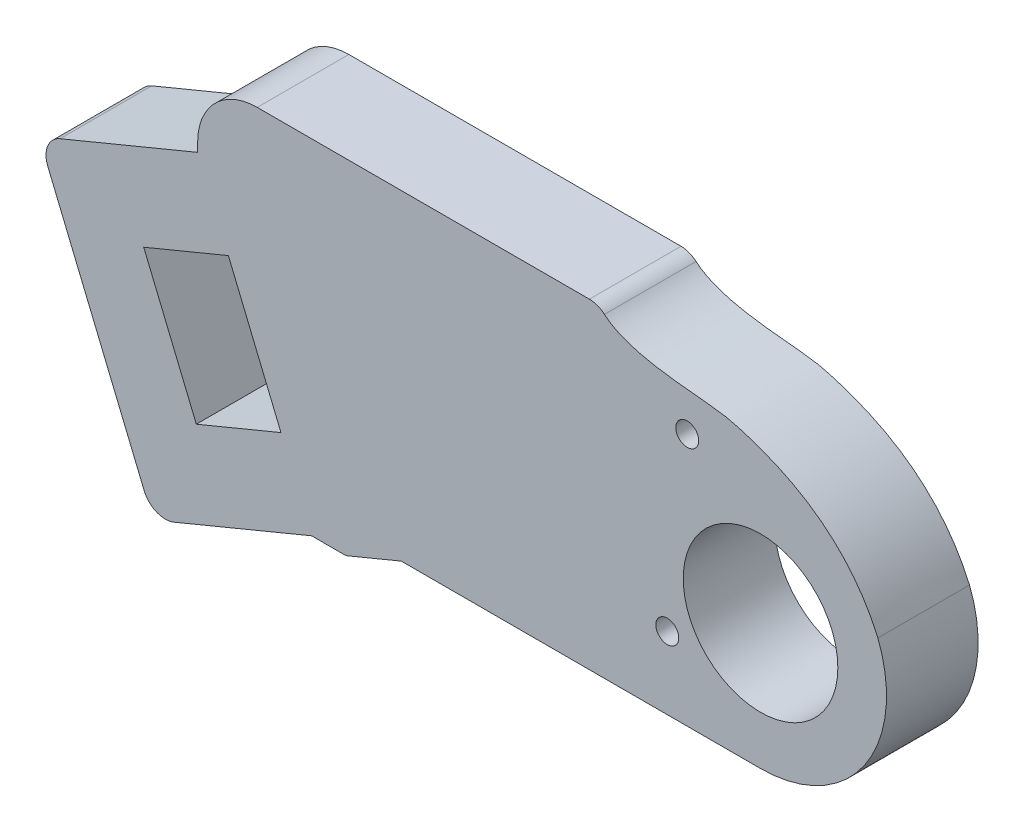
from build123d import *

# Parameters (mm, degrees)
SCHIZZO1_R                   = 3.375
ESTRUSIONE_ESTRUSIONE1_DEPTH = 4
SCHIZZO2_R                   = 0.5
TAGLIO_ESTRUSIONE1_DEPTH     = 33.728866359


with BuildPart() as part:
    # Schizzo1 → Estrusione-Estrusione1 (new body)
    # profile 1 of 3: a face of its own
    with BuildSketch(Plane.XY):
        with BuildLine():
            Line((-7.470903506, 8.510433923), (-21.970903506, 8.510433923))
            ThreePointArc((-21.970903506, 8.510433923), (-23.809381137, 7.748911554), (-24.570903506, 5.910433923))
            Line((-24.570903506, 5.910433923), (-24.570903506, 5.510433923))
            Line((-24.570903506, 5.510433923), (-23.231511493, 2.276855559))
            Line((-23.231511493, 2.276855559), (-20.935410899, -3.266421636))
            Line((-20.935410899, -3.266421636), (-19.596018885, -6.5))
            Line((-19.596018885, -6.5), (-18.096018885, -6.5))
            Line((-18.096018885, -6.5), (-15.681805323, -5.5))
            Line((-15.681805323, -5.5), (0, -5.5))
            ThreePointArc((0, -5.5), (-4.870304143, 2.555413382), (4.525687412, 3.125404526))
            add(Edge.make_bspline(
                [(-6.813259247, 8.263762555), (-5.684863842, 7.278690798), (-2.241998389, 7.261523866), (-0.103772907, 6.677709947), (2.942400696, 5.613801426), (4.525687412, 3.125404526)],
                knots=[0.028629025, 0.028629025, 0.028629025, 0.028629025, 0.40264023, 0.499777327, 0.939347162, 0.939347162, 0.939347162, 0.939347162], degree=3))
            ThreePointArc((-6.813259247, 8.263762555), (-7.119711701, 8.446737461), (-7.470903506, 8.510433923))
        make_face()
    # profile 2 of 3: a face of its own
    with BuildSketch(Plane.XY):
        with BuildLine():
            add(Edge.make_bspline(
                [(4.525687412, 3.125404526), (4.744152888, 2.782049902), (4.94526292, 2.407908244), (5.123475383, 2)],
                knots=[0.939347162, 0.939347162, 0.939347162, 0.939347162, 1, 1, 1, 1], degree=3))
            ThreePointArc((4.525687412, 3.125404526), (-4.870304143, 2.555413382), (0, -5.5))
            ThreePointArc((0, -5.5), (3.889087297, -3.889087297), (5.5, 0))
            ThreePointArc((5.5, 0), (5.405049242, 1.017567048), (5.123475383, 2))
        make_face()
        Circle(SCHIZZO1_R, mode=Mode.SUBTRACT)
    # profile 3 of 3: a face of its own
    with BuildSketch(Plane.XY):
        with BuildLine():
            Line((-23.231511493, 2.276855559), (-24.570903506, 5.510433923))
            Line((-24.570903506, 5.510433923), (-30.576120467, 3.022991612))
            ThreePointArc((-30.576120467, 3.022991612), (-31.117316568, 2.481795512), (-31.117316568, 1.716428647))
            Line((-31.117316568, 1.716428647), (-26.907798812, -8.44624621))
            ThreePointArc((-26.907798812, -8.44624621), (-26.366602711, -8.98744231), (-25.601235847, -8.98744231))
            Line((-25.601235847, -8.98744231), (-19.596018885, -6.5))
            Line((-19.596018885, -6.5), (-20.935410899, -3.266421636))
            Line((-20.935410899, -3.266421636), (-24.630929029, -4.797155366))
            Line((-24.630929029, -4.797155366), (-26.927029623, 0.746121829))
            Line((-26.927029623, 0.746121829), (-23.231511493, 2.276855559))
        make_face()
    extrude(amount=ESTRUSIONE_ESTRUSIONE1_DEPTH)

    # Schizzo2 → Taglio-Estrusione1 (cut, through all)
    with BuildSketch(Plane.XY.offset(4)):
        with Locations((-3.2, 5.542562584)):
            Circle(SCHIZZO2_R)
        with Locations((-4.070319398, -2.35)):
            Circle(SCHIZZO2_R)
    extrude(amount=-TAGLIO_ESTRUSIONE1_DEPTH, mode=Mode.SUBTRACT)


solid = part.part
